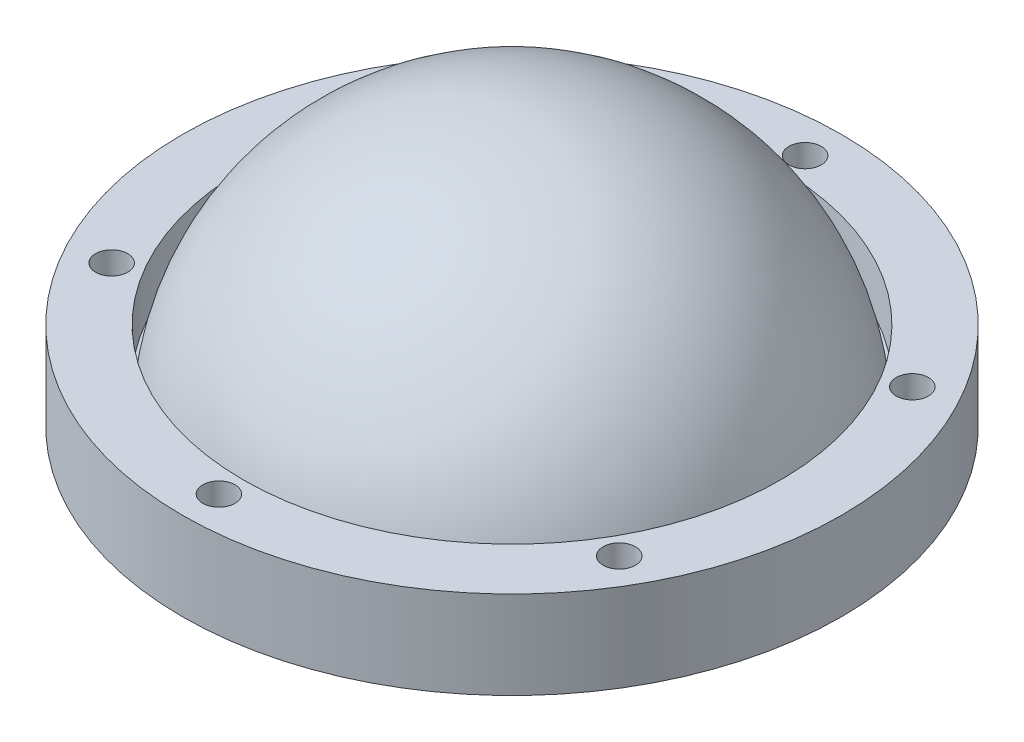
from build123d import *

# Parameters (mm, degrees)
SKETCH2_R           = 67.5
BOSS_EXTRUDE1_DEPTH = 8
SKETCH6_R           = 67.5
SKETCH6_R_2         = 55
BOSS_EXTRUDE2_DEPTH = 10
SKETCH7_R           = 3.3
CUT_EXTRUDE3_DEPTH  = 15
CIRPATTERN2_COUNT   = 6


with BuildPart() as part:
    # Sketch1 → Revolve1 (revolve)
    with BuildSketch(Plane.XY, mode=Mode.PRIVATE) as revolve1_sk:
        with BuildLine():
            Line((-65, 0), (-65, 5))
            Line((-65, 5), (-54.772255751, 5))
            ThreePointArc((-54.772255751, 5), (-37.080992435, 40.620192023), (0, 55))
            Line((0, 55), (0, 50))
            ThreePointArc((0, 50), (-35.355339059, 35.355339059), (-50, 0))
            Line((-50, 0), (-65, 0))
        make_face()
    revolve(revolve1_sk.sketch.rotate(Axis((0, 0, 0), (0, 1, 0)), 180), axis=Axis((0, 0, 0), (0, 1, 0)))

    # Sketch2 → Boss-Extrude1 (add)
    with BuildSketch(Plane(origin=(0, 0, 0), x_dir=(1, 0, 0), z_dir=(0, 1, 0))):
        with Locations(Location((0, 0, 0), (0, 0, 270))):
            Circle(SKETCH2_R)
    extrude(amount=BOSS_EXTRUDE1_DEPTH)

    # Sketch6 → Boss-Extrude2 (add)
    with BuildSketch(Plane(origin=(0, 8, 0), x_dir=(1, 0, 0), z_dir=(0, 1, 0))):
        with Locations(Location((0, 0, 0), (0, 0, 270))):
            Circle(SKETCH6_R)
        with Locations(Location((0, 0, 0), (0, 0, 270))):
            Circle(SKETCH6_R_2, mode=Mode.SUBTRACT)
    extrude(amount=BOSS_EXTRUDE2_DEPTH)

    # Sketch7 → Cut-Extrude3 (cut)
    with BuildSketch(Plane(origin=(0, 18, 0), x_dir=(1, 0, 0), z_dir=(0, 1, 0))):
        with Locations(Location((0, -60, 0), (0, 0, 270))):
            Circle(SKETCH7_R)
    cut_extrude3 = extrude(amount=-CUT_EXTRUDE3_DEPTH, mode=Mode.SUBTRACT)

    # CirPattern2: Cut-Extrude3 ×6 about axis
    cirpattern2_axis = Axis((0, 0, 0), (0, 1, 0))
    for i in range(1, CIRPATTERN2_COUNT):
        add(cut_extrude3.rotate(cirpattern2_axis, i * 360 / CIRPATTERN2_COUNT), mode=Mode.SUBTRACT)


solid = part.part
